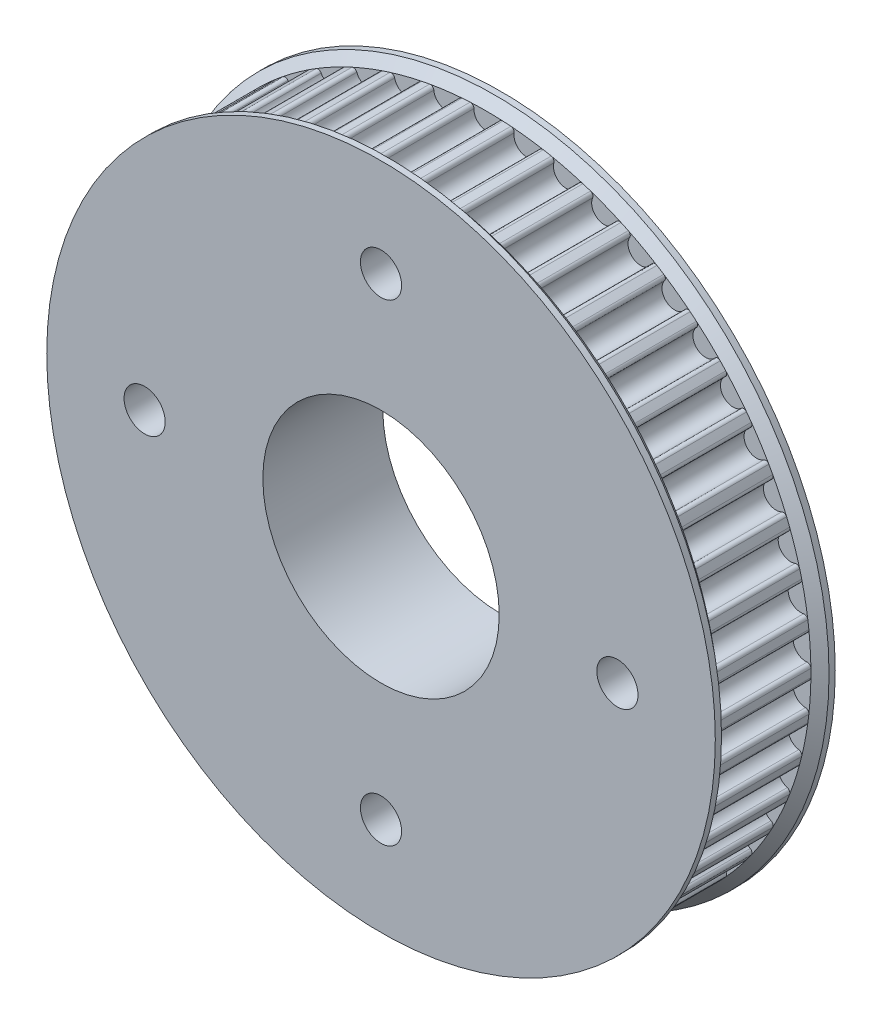
from build123d import *

# Parameters (mm, degrees)
CROQUIS2_R                 = 39.217235773
SALIENTE_EXTRUIR1_DEPTH    = 5.5
CORTAR_EXTRUIR2_DEPTH      = 56.733590978
MATRIZC4_COUNT             = 50
CORTAR_EXTRUIR3_DEPTH      = 58.604994081
CORTAR_EXTRUIR3_DEPTH_BACK = 58.604994081
CROQUIS7_R                 = 14.2875
CROQUIS7_R_2               = 2.4892
CORTAR_EXTRUIR4_DEPTH      = 59.957805616


with BuildPart() as part:
    # Croquis2 → Saliente-Extruir1 (new, symmetric)
    with BuildSketch(Plane.XY):
        Circle(CROQUIS2_R)
    extrude(amount=SALIENTE_EXTRUIR1_DEPTH, both=True)

    # Croquis4 → Cortar-Extruir2 (cut, symmetric)
    with BuildSketch(Plane.XY):
        with BuildLine():
            ThreePointArc((-1.975869789, 39.167429329), (0, 39.217235773), (1.975869789, 39.167429329))
            ThreePointArc((1.975869789, 39.167429329), (1.653495174, 39.045340789), (1.524380041, 38.725715561))
            ThreePointArc((1.524380041, 38.725715561), (0, 37.157235773), (-1.524380041, 38.725715561))
            ThreePointArc((-1.524380041, 38.725715561), (-1.653495174, 39.045340789), (-1.975869789, 39.167429329))
        make_face()
    cortar_extruir2 = extrude(amount=CORTAR_EXTRUIR2_DEPTH, both=True, mode=Mode.SUBTRACT)

    # MatrizC4: Cortar-Extruir2 ×50 about axis
    matrizc4_axis = Axis((0, 0, 0), (0, 0, 1))
    for i in range(1, MATRIZC4_COUNT):
        add(cortar_extruir2.rotate(matrizc4_axis, i * 360 / MATRIZC4_COUNT), mode=Mode.SUBTRACT)

    # Croquis5 → Revolución1 (revolve)
    with BuildSketch(Plane(origin=(0, 0, 0), x_dir=(1, 0, 0), z_dir=(0, 1, 0))):
        Polygon((0, 5.5), (39.217235773, 5.5), (40.408989366, 6.5), (40.408989366, 7.25), (0, 7.25), align=None)
        Polygon((0, -7.25), (0, -5.5), (39.217235773, -5.5), (40.408989366, -6.5), (40.408989366, -7.25), align=None)
    revolve(axis=Axis((0, 0, 0), (0, 0, -1)))

    # Croquis6 → Cortar-Extruir3 (cut, two sides: drawn at the far end of the back side and taken through both)
    with BuildSketch(Plane.XY.offset(-CORTAR_EXTRUIR3_DEPTH_BACK)):
        Polygon((2.995350932, -6.3881), (3.688171255, -6.3881), (4.034581416, -5.7881), (7.029932348, -0.6), (7.376342509, 0), (7.029932348, 0.6), (4.034581416, 5.7881), (3.688171255, 6.3881), (2.995350932, 6.3881), (-2.995350932, 6.3881), (-3.688171255, 6.3881), (-4.034581416, 5.7881), (-7.029932348, 0.6), (-7.376342509, 0), (-7.029932348, -0.6), (-4.034581416, -5.7881), (-3.688171255, -6.3881), (-2.995350932, -6.3881), align=None)
        with BuildLine():
            Line((3.688171255, 6.3881), (4.034581416, 5.7881))
            ThreePointArc((4.034581416, 5.7881), (3.980991578, 5.9881), (4.034581416, 6.1881))
            ThreePointArc((4.034581416, 6.1881), (3.888171255, 6.734510162), (3.341761093, 6.5881))
            ThreePointArc((3.341761093, 6.5881), (3.195350932, 6.441689838), (2.995350932, 6.3881))
            Line((2.995350932, 6.3881), (3.688171255, 6.3881))
        make_face()
        with BuildLine():
            Line((-3.688171255, 6.3881), (-2.995350932, 6.3881))
            ThreePointArc((-2.995350932, 6.3881), (-3.195350932, 6.441689838), (-3.341761093, 6.5881))
            ThreePointArc((-3.341761093, 6.5881), (-3.888171255, 6.734510162), (-4.034581416, 6.1881))
            ThreePointArc((-4.034581416, 6.1881), (-3.980991578, 5.9881), (-4.034581416, 5.7881))
            Line((-4.034581416, 5.7881), (-3.688171255, 6.3881))
        make_face()
        with BuildLine():
            ThreePointArc((-7.376342509, -0.4), (-7.176342509, -0.453589838), (-7.029932348, -0.6))
            Line((-7.029932348, -0.6), (-7.376342509, 0))
            Line((-7.376342509, 0), (-7.029932348, 0.6))
            ThreePointArc((-7.029932348, 0.6), (-7.176342509, 0.453589838), (-7.376342509, 0.4))
            ThreePointArc((-7.376342509, 0.4), (-7.776342509, 0), (-7.376342509, -0.4))
        make_face()
        with BuildLine():
            ThreePointArc((-3.341761093, -6.5881), (-3.195350932, -6.441689838), (-2.995350932, -6.3881))
            Line((-2.995350932, -6.3881), (-3.688171255, -6.3881))
            Line((-3.688171255, -6.3881), (-4.034581416, -5.7881))
            ThreePointArc((-4.034581416, -5.7881), (-3.980991578, -5.9881), (-4.034581416, -6.1881))
            ThreePointArc((-4.034581416, -6.1881), (-3.888171255, -6.734510162), (-3.341761093, -6.5881))
        make_face()
        with BuildLine():
            Line((4.034581416, -5.7881), (3.688171255, -6.3881))
            Line((3.688171255, -6.3881), (2.995350932, -6.3881))
            ThreePointArc((2.995350932, -6.3881), (3.195350932, -6.441689838), (3.341761093, -6.5881))
            ThreePointArc((3.341761093, -6.5881), (3.888171255, -6.734510162), (4.034581416, -6.1881))
            ThreePointArc((4.034581416, -6.1881), (3.980991578, -5.9881), (4.034581416, -5.7881))
        make_face()
        with BuildLine():
            Line((7.376342509, 0), (7.029932348, -0.6))
            ThreePointArc((7.029932348, -0.6), (7.176342509, -0.453589838), (7.376342509, -0.4))
            ThreePointArc((7.376342509, -0.4), (7.776342509, 0), (7.376342509, 0.4))
            ThreePointArc((7.376342509, 0.4), (7.176342509, 0.453589838), (7.029932348, 0.6))
            Line((7.029932348, 0.6), (7.376342509, 0))
        make_face()
    extrude(amount=CORTAR_EXTRUIR3_DEPTH + CORTAR_EXTRUIR3_DEPTH_BACK, mode=Mode.SUBTRACT)

    # Croquis7 → Cortar-Extruir4 (cut, through all)
    with BuildSketch(Plane.XY.offset(7.25)):
        Circle(CROQUIS7_R)
        with Locations((0, 28.575)):
            Circle(CROQUIS7_R_2)
        with Locations((-28.575, 0)):
            Circle(CROQUIS7_R_2)
        with Locations((0, -28.575)):
            Circle(CROQUIS7_R_2)
        with Locations((28.575, 0)):
            Circle(CROQUIS7_R_2)
    extrude(amount=-CORTAR_EXTRUIR4_DEPTH, mode=Mode.SUBTRACT)


solid = part.part
